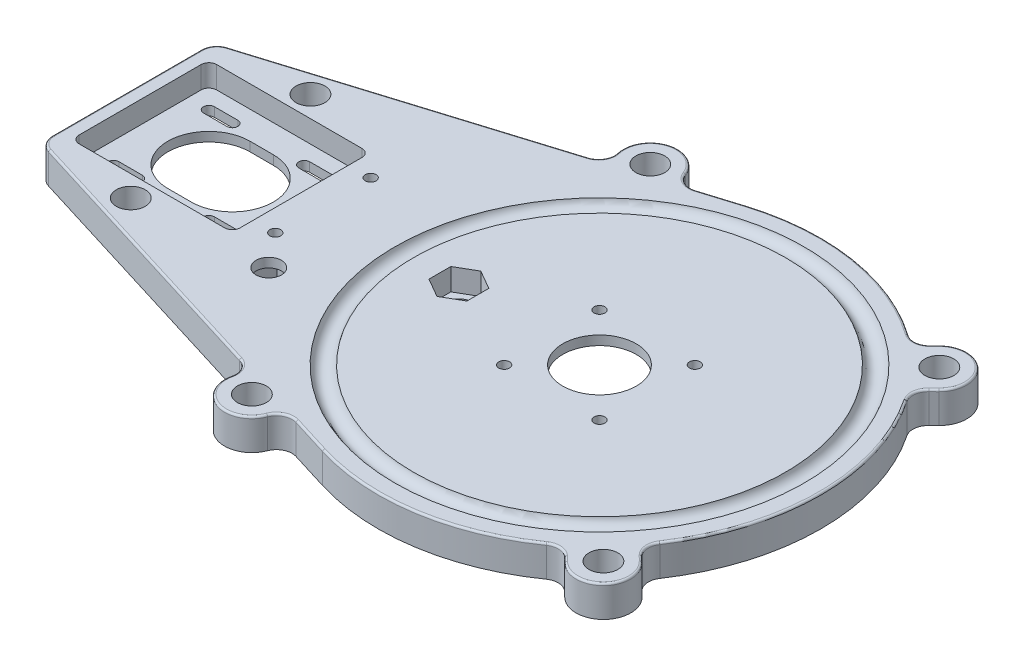
from build123d import *

# Parameters (mm, degrees)
SKETCH1_R                      = 2.5781
BOSS_EXTRUDE1_DEPTH            = 10.16
FILLET1_R                      = 5.08
SKETCH2_R                      = 11.938
SKETCH2_R_2                    = 1.7653
HOLES_RSTEPPERMOTOR_DEPTH      = 171.714645381
SKETCH3_R                      = 3.1242
SKETCH9_R                      = 4.1275
HOLES_PROXIMITYSENSORS_DEPTH   = 171.714645381
RELIEF_RSTEPPERMOTOR_START     = -7.16
SKETCH4_W                      = 45.72
SKETCH4_H                      = 45.72
RELIEF_RSTEPPERMOTOR_DEPTH     = 7.16
SKETCH7_R                      = 2.5781
HOLES_THETASTEPPERMOTOR_DEPTH  = 171.714645381
RELIEF_THETASTEPPERMOTOR_START = -7.16
SKETCH8_R                      = 4.699
SKETCH8_W                      = 52.324
SKETCH8_H                      = 44.704
RELIEF_THETASTEPPERMOTOR_DEPTH = 7.16
FILLET_STEPPERMOTORS_R         = 2.54
FILLET2_R                      = 0.635
SKETCH10_R                     = 1.7653
HOLES_MOTORSLIDESTOP_DEPTH     = 171.714645381


with BuildPart() as part:
    # Sketch1 → Boss-Extrude1 (new body)
    with BuildSketch(Plane(origin=(0, 0, 0), x_dir=(1, 0, 0), z_dir=(0, 1, 0))):
        with BuildLine():
            Line((-153.67, 27.94), (-153.67, 0))
            Line((-153.67, 0), (-153.67, -27.94))
            Line((-153.67, -27.94), (-55.542490337, -58.220166448))
            Line((-55.542490337, -58.220166448), (-56.754753539, -62.148690726))
            ThreePointArc((-56.754753539, -62.148690726), (-50.881309274, -73.264753539), (-39.765246461, -67.391309274))
            Line((-39.765246461, -67.391309274), (-38.552983259, -63.462784996))
            Line((-38.552983259, -63.462784996), (-21.232605118, -68.807503667))
            ThreePointArc((-21.232605118, -68.807503667), (13.380613928, -70.754895604), (44.892424366, -56.302453904))
            Line((44.892424366, -56.302453904), (49.666486094, -60.968014229))
            ThreePointArc((49.666486094, -60.968014229), (62.238014229, -60.823513906), (62.093513906, -48.251985771))
            Line((62.093513906, -48.251985771), (57.319452177, -43.586425445))
            ThreePointArc((57.319452177, -43.586425445), (72.009, 0), (57.319452177, 43.586425445))
            Line((57.319452177, 43.586425445), (62.093513906, 48.251985771))
            ThreePointArc((62.093513906, 48.251985771), (62.238014229, 60.823513906), (49.666486094, 60.968014229))
            Line((49.666486094, 60.968014229), (44.892424366, 56.302453904))
            ThreePointArc((44.892424366, 56.302453904), (13.380613928, 70.754895604), (-21.232605118, 68.807503667))
            Line((-21.232605118, 68.807503667), (-38.552983259, 63.462784996))
            Line((-38.552983259, 63.462784996), (-39.765246461, 67.391309274))
            ThreePointArc((-39.765246461, 67.391309274), (-50.881309274, 73.264753539), (-56.754753539, 62.148690726))
            Line((-56.754753539, 62.148690726), (-55.542490337, 58.220166448))
            Line((-55.542490337, 58.220166448), (-153.67, 27.94))
        make_face()
        with Locations(Location((55.88, 54.61, 0), (0, 0, 270))):
            Circle(SKETCH1_R, mode=Mode.SUBTRACT)
        with Locations(Location((55.88, -54.61, 0), (0, 0, 270))):
            Circle(SKETCH1_R, mode=Mode.SUBTRACT)
        with Locations(Location((-48.26, 64.77, 0), (0, 0, 270))):
            Circle(SKETCH1_R, mode=Mode.SUBTRACT)
        with Locations(Location((-48.26, -64.77, 0), (0, 0, 270))):
            Circle(SKETCH1_R, mode=Mode.SUBTRACT)
    extrude(amount=BOSS_EXTRUDE1_DEPTH)

    # Fillet1
    fillet1_edges = [part.edges().sort_by_distance(p)[0] for p in [
        (44.892424366, 5.08, -56.302453904),
        (44.892424366, 5.08, 56.302453904),
        (57.319452177, 5.08, 43.586425445),
        (57.319452177, 5.08, -43.586425445),
        (-153.67, 5.08, -27.94),
        (-153.67, 5.08, 27.94),
        (-38.552983259, 5.08, 63.462784996),
        (-55.542490337, 5.08, 58.220166448),
        (-55.542490337, 5.08, -58.220166448),
        (-38.552983259, 5.08, -63.462784996),
    ]]
    fillet(fillet1_edges, radius=FILLET1_R)

    # Sketch2 → Holes-RStepperMotor (cut, through all)
    with BuildSketch(Plane(origin=(0, 10.16, 0), x_dir=(1, 0, 0), z_dir=(0, 1, 0))):
        with Locations(Location((0, 0, 0), (0, 0, 270))):
            Circle(SKETCH2_R)
        with Locations(Location((15.5, 15.5, 0), (0, 0, 270))):
            Circle(SKETCH2_R_2)
        with Locations(Location((-15.5, 15.5, 0), (0, 0, 270))):
            Circle(SKETCH2_R_2)
        with Locations(Location((-15.5, -15.5, 0), (0, 0, 270))):
            Circle(SKETCH2_R_2)
        with Locations(Location((15.5, -15.5, 0), (0, 0, 270))):
            Circle(SKETCH2_R_2)
    extrude(amount=-HOLES_RSTEPPERMOTOR_DEPTH, mode=Mode.SUBTRACT)

    # Sketch3 → SlotForBalls (revolve, cut)
    with BuildSketch(Plane(origin=(0, 0, 0), x_dir=(1, 0, 0), z_dir=(0, 0, -1)), mode=Mode.PRIVATE) as slotforballs_sk:
        with Locations((-63.5, -10.8712)):
            Circle(SKETCH3_R)
    revolve(slotforballs_sk.sketch.rotate(Axis((0, 6.6675, 0), (0, -1, 0)), 270), axis=Axis((0, 6.6675, 0), (0, -1, 0)), mode=Mode.SUBTRACT)

    # Sketch9 → Holes-ProximitySensors (cut, through all)
    with BuildSketch(Plane(origin=(0, 10.16, 0), x_dir=(1, 0, 0), z_dir=(0, 1, 0))):
        with Locations(Location((-45.72, 0, 0), (0, 0, 270))):
            Circle(SKETCH9_R)
        with Locations(Location((-81.166967327, -26.372746368, 0), (0, 0, 270))):
            Circle(SKETCH9_R)
    extrude(amount=-HOLES_PROXIMITYSENSORS_DEPTH, mode=Mode.SUBTRACT)

    # Sketch4 → Relief-RStepperMotor (cut)
    with BuildSketch(Plane.XZ.offset(RELIEF_RSTEPPERMOTOR_START)):
        Rectangle(SKETCH4_W, SKETCH4_H)
        Polygon((-84.730488658, 20.200546368), (-77.603445995, 20.200546368), (-74.039924664, 26.372746368), (-77.603445995, 32.544946368), (-84.730488658, 32.544946368), (-88.29400999, 26.372746368), align=None)
    extrude(amount=RELIEF_RSTEPPERMOTOR_DEPTH, mode=Mode.SUBTRACT)

    # Sketch7 → Holes-ThetaStepperMotor (cut, through all)
    with BuildSketch(Plane(origin=(0, 10.16, 0), x_dir=(1, 0, 0), z_dir=(0, 1, 0))):
        with Locations(Location((-123.19, -29.21, 0), (0, 0, 270))):
            Circle(SKETCH7_R)
        with Locations(Location((-123.19, 29.21, 0), (0, 0, 270))):
            Circle(SKETCH7_R)
        with BuildLine():
            Line((-142.5, 17.2653), (-134.88, 17.2653))
            ThreePointArc((-134.88, 17.2653), (-133.1147, 15.5), (-134.88, 13.7347))
            Line((-134.88, 13.7347), (-142.5, 13.7347))
            ThreePointArc((-142.5, 13.7347), (-144.2653, 15.5), (-142.5, 17.2653))
        make_face()
        with BuildLine():
            Line((-103.88, 17.2653), (-111.5, 17.2653))
            ThreePointArc((-111.5, 17.2653), (-113.2653, 15.5), (-111.5, 13.7347))
            Line((-111.5, 13.7347), (-103.88, 13.7347))
            ThreePointArc((-103.88, 13.7347), (-102.1147, 15.5), (-103.88, 17.2653))
        make_face()
        with BuildLine():
            Line((-142.5, -17.2653), (-134.88, -17.2653))
            ThreePointArc((-134.88, -17.2653), (-133.1147, -15.5), (-134.88, -13.7347))
            Line((-134.88, -13.7347), (-142.5, -13.7347))
            ThreePointArc((-142.5, -13.7347), (-144.2653, -15.5), (-142.5, -17.2653))
        make_face()
        with BuildLine():
            Line((-111.5, -17.2653), (-103.88, -17.2653))
            ThreePointArc((-103.88, -17.2653), (-102.1147, -15.5), (-103.88, -13.7347))
            Line((-103.88, -13.7347), (-111.5, -13.7347))
            ThreePointArc((-111.5, -13.7347), (-113.2653, -15.5), (-111.5, -17.2653))
        make_face()
        with BuildLine():
            Line((-127, 13.335), (-119.38, 13.335))
            ThreePointArc((-119.38, 13.335), (-106.045, 0), (-119.38, -13.335))
            Line((-119.38, -13.335), (-127, -13.335))
            ThreePointArc((-127, -13.335), (-140.335, 0), (-127, 13.335))
        make_face()
    extrude(amount=-HOLES_THETASTEPPERMOTOR_DEPTH, mode=Mode.SUBTRACT)

    # Sketch8 → Relief-ThetaStepperMotor (cut)
    with BuildSketch(Plane(origin=(0, 10.16, 0), x_dir=(1, 0, 0), z_dir=(0, 1, 0)).offset(RELIEF_THETASTEPPERMOTOR_START)):
        with Locations(Location((-123.19, 29.21, 0), (0, 0, 270))):
            Circle(SKETCH8_R)
        with Locations(Location((-123.19, -29.21, 0), (0, 0, 270))):
            Circle(SKETCH8_R)
        with Locations(Location((-48.26, -64.77, 0), (0, 0, 270))):
            Circle(SKETCH8_R)
        with Locations(Location((55.88, -54.61, 0), (0, 0, 270))):
            Circle(SKETCH8_R)
        with Locations(Location((55.88, 54.61, 0), (0, 0, 270))):
            Circle(SKETCH8_R)
        with Locations(Location((-48.26, 64.77, 0), (0, 0, 270))):
            Circle(SKETCH8_R)
        with Locations((-123.19, 0)):
            Rectangle(SKETCH8_W, SKETCH8_H)
        Polygon((-45.72, -7.127042663), (-39.5478, -3.563521331), (-39.5478, 3.563521331), (-45.72, 7.127042663), (-51.8922, 3.563521331), (-51.8922, -3.563521331), align=None)
    extrude(amount=RELIEF_THETASTEPPERMOTOR_DEPTH, mode=Mode.SUBTRACT)

    # Fillet-StepperMotors
    fillet_steppermotors_edges = [part.edges().sort_by_distance(p)[0] for p in [
        (-22.86, 3.58, 22.86),
        (-22.86, 3.58, -22.86),
        (22.86, 3.58, -22.86),
        (22.86, 3.58, 22.86),
        (-97.028, 6.58, 22.352),
        (-97.028, 6.58, -22.352),
        (-149.352, 6.58, -22.352),
        (-149.352, 6.58, 22.352),
    ]]
    fillet(fillet_steppermotors_edges, radius=FILLET_STEPPERMOTORS_R)

    # Fillet2
    fillet2_edges = [part.edges().sort_by_distance(p)[0] for p in [
        (-37.444843194, 10.16, 65.23371192),
        (-57.455862076, 10.16, 59.058715891),
        (-57.455862076, 10.16, -59.058715891),
        (-37.444843194, 10.16, -65.23371192),
        (44.860159236, 10.16, -57.91519479),
        (44.860159236, 10.16, 57.91519479),
        (58.931025347, 10.16, 43.517099235),
        (58.931025347, 10.16, -43.517099235),
        (11.307262763, 10.16, 71.115693696),
        (62.238014229, 10.16, 60.823513906),
        (61.263620929, 10.16, 47.440953998),
        (62.238014229, 10.16, -60.823513906),
        (48.836593117, 10.16, -60.156982457),
        (-27.481786855, 10.16, -66.879132471),
        (-153.67, 10.16, 0),
        (-105.22619801, 10.16, -42.888778306),
        (-105.22619801, 10.16, 42.888778306),
        (-50.881309274, 10.16, 73.264753539),
        (-27.481786855, 10.16, 66.879132471),
        (48.836593117, 10.16, 60.156982457),
        (72.009, 10.16, 0),
        (61.263620929, 10.16, -47.440953998),
        (11.307262763, 10.16, -71.115693696),
        (-50.881309274, 10.16, -73.264753539),
        (-152.677522865, 10.16, 27.207602976),
        (-152.677522865, 10.16, -27.207602976),
    ]]
    fillet(fillet2_edges, radius=FILLET2_R)

    # Sketch10 → Holes-MotorSlideStop (cut, through all)
    with BuildSketch(Plane(origin=(0, 10.16, 0), x_dir=(1, 0, 0), z_dir=(0, 1, 0))):
        with Locations(Location((-89.916, 15.5, 0), (0, 0, 270))):
            Circle(SKETCH10_R)
        with Locations(Location((-89.916, -15.5, 0), (0, 0, 270))):
            Circle(SKETCH10_R)
    extrude(amount=-HOLES_MOTORSLIDESTOP_DEPTH, mode=Mode.SUBTRACT)


solid = part.part
